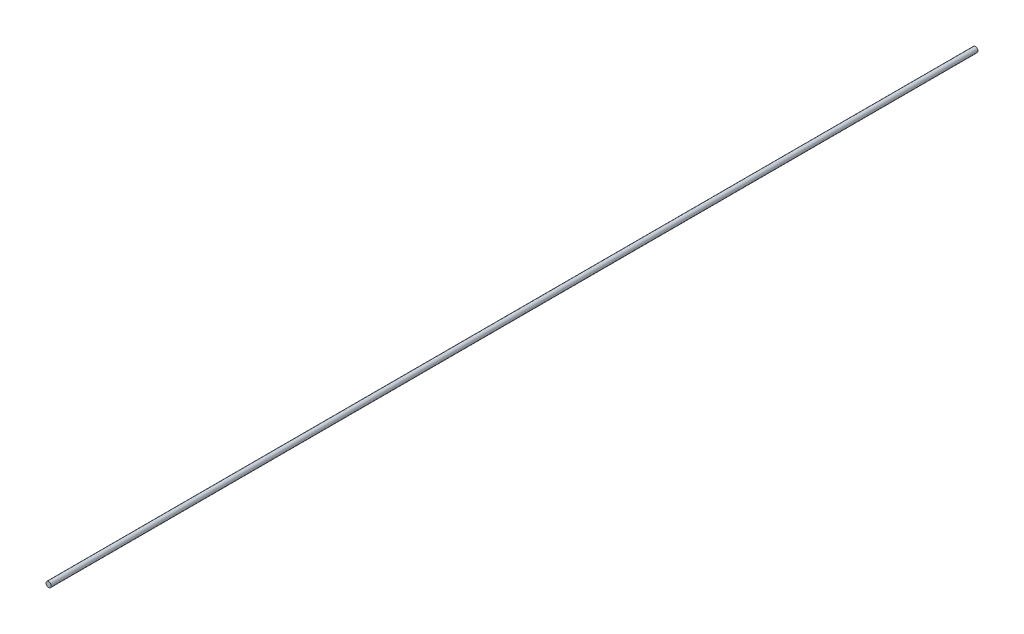
from build123d import *

# Parameters (mm, degrees)
SKETCH1_R           = 12.7
BOSS_EXTRUDE2_DEPTH = 4488.5504844


with BuildPart() as part:
    # Sketch1 → Boss-Extrude2 (new body)
    with BuildSketch(Plane.XY):
        Circle(SKETCH1_R)
    extrude(amount=BOSS_EXTRUDE2_DEPTH)


solid = part.part
